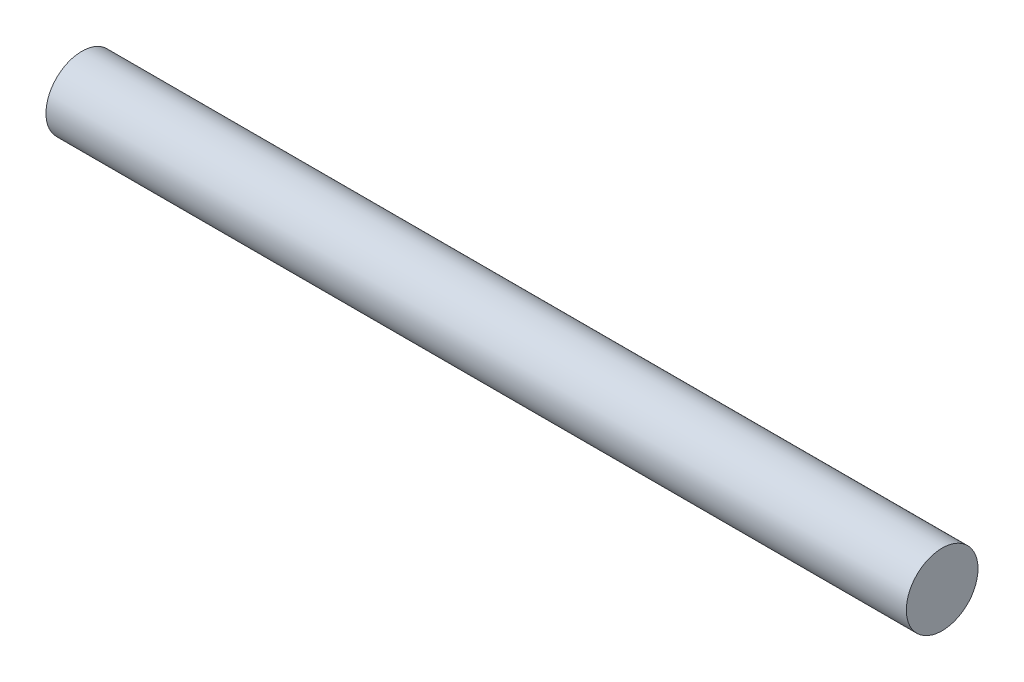
from build123d import *

# Parameters (mm, degrees)
ESBO_O1_R                = 0.5
RESSALTO_EXTRUS_O1_DEPTH = 12


with BuildPart() as part:
    # Esboço1 → Ressalto-extrusão1 (new body)
    with BuildSketch(Plane(origin=(0, 0, 0), x_dir=(0, 0, -1), z_dir=(1, 0, 0))):
        Circle(ESBO_O1_R)
    extrude(amount=RESSALTO_EXTRUS_O1_DEPTH)


solid = part.part
